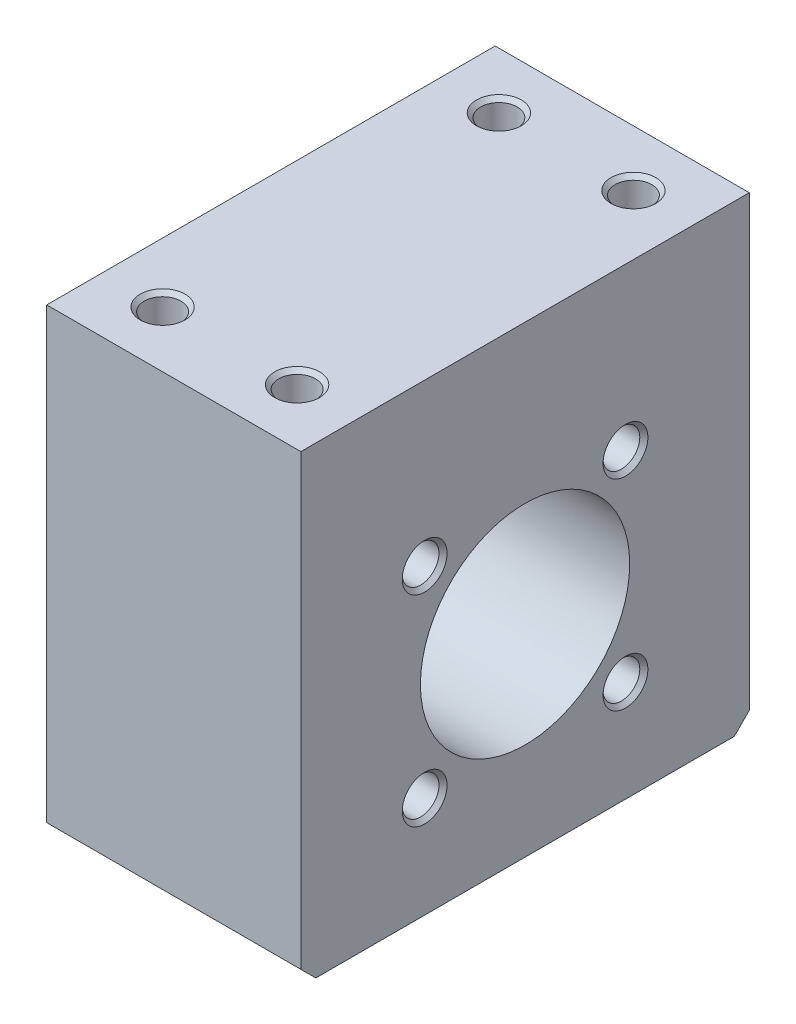
from build123d import *

# Parameters (mm, degrees)
SCHIZZO1_W                   = 60
SCHIZZO1_H                   = 62
ESTRUSIONE_ESTRUSIONE1_DEPTH = 34
FORO_PER_VITE_M24_1_D        = 28
FORO1_D                      = 4.917
FORO1_DEPTH                  = 14.312635171
FORO1_TIP                    = 1.419415637
FORO2_D                      = 4.917
FORO2_DEPTH                  = 12.312635171
FORO2_TIP                    = 1.419415637
SMUSSO1_SIZE                 = 0.5415
SMUSSO2_SIZE                 = 2


with BuildPart() as part:
    # Schizzo1 → Estrusione-Estrusione1 (new body)
    with BuildSketch(Plane(origin=(17, 0, 0), x_dir=(0, 0, -1), z_dir=(1, 0, 0))):
        with Locations((0, 4)):
            Rectangle(SCHIZZO1_W, SCHIZZO1_H)
    extrude(amount=-ESTRUSIONE_ESTRUSIONE1_DEPTH)

    # Foro per Vite M24-1 (through all)
    with Locations(Plane(origin=(17, 0, 0), x_dir=(0, 0, -1), z_dir=(1, 0, 0))):
        with Locations((0, 0)):
            Hole(FORO_PER_VITE_M24_1_D / 2)

    # Foro1
    with Locations(Plane(origin=(0, 35, 0), x_dir=(1, 0, 0), z_dir=(0, 1, 0))):
        with Locations((9, 22.5), (9, -22.5), (-9, 22.5), (-9, -22.5)):
            Hole(FORO1_D / 2, depth=FORO1_DEPTH)
            with Locations((0, 0, -(FORO1_DEPTH + FORO1_TIP / 2))):  # 120° drill point
                Cone(0, FORO1_D / 2, FORO1_TIP, mode=Mode.SUBTRACT)

    # Foro2
    with Locations(Plane(origin=(17, 0, 0), x_dir=(0, 0, -1), z_dir=(1, 0, 0))):
        with Locations((13.435028843, 13.435028843), (-13.435028843, -13.435028843), (13.435028843, -13.435028843), (-13.435028843, 13.435028843)):
            Hole(FORO2_D / 2, depth=FORO2_DEPTH)
            with Locations((0, 0, -(FORO2_DEPTH + FORO2_TIP / 2))):  # 120° drill point
                Cone(0, FORO2_D / 2, FORO2_TIP, mode=Mode.SUBTRACT)

    # Smusso1
    smusso1_edges = [part.edges().sort_by_distance(p)[0] for p in [
        (-6.5415, 35, 22.5),
        (-6.5415, 35, -22.5),
        (11.4585, 35, 22.5),
        (11.4585, 35, -22.5),
        (17, 13.435028843, 10.976528843),
        (17, -13.435028843, -15.893528843),
        (17, -13.435028843, 10.976528843),
        (17, 13.435028843, -15.893528843),
    ]]
    chamfer(smusso1_edges, length=SMUSSO1_SIZE)

    # Smusso2
    smusso2_edges = [part.edges().sort_by_distance(p)[0] for p in [
        (0, -27, 30),
        (0, -27, -30),
    ]]
    chamfer(smusso2_edges, length=SMUSSO2_SIZE)


solid = part.part
